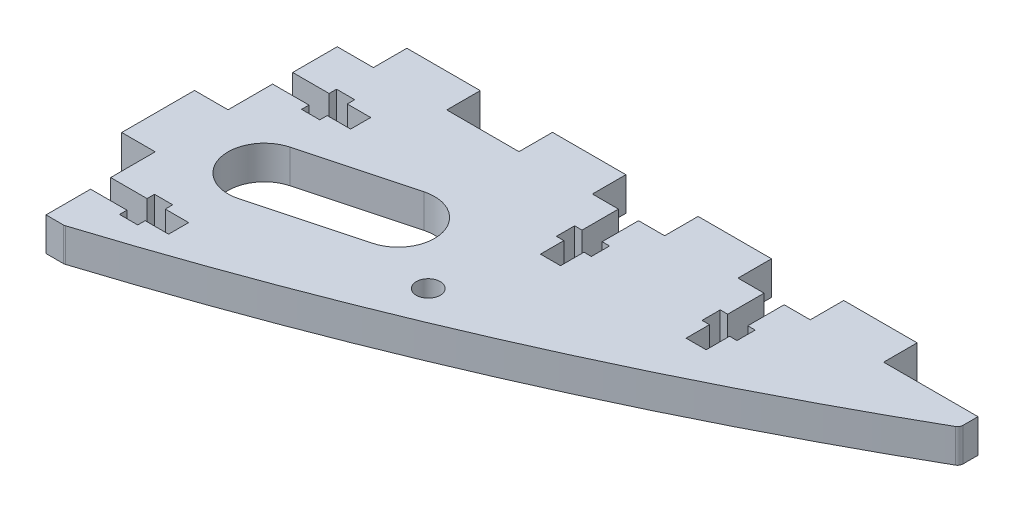
from build123d import *

# Parameters (mm, degrees)
BOSS_EXTRUDE1_DEPTH = 5.842
CUT_EXTRUDE1_DEPTH  = 123.902671239
FILLET1_R           = 1
CUT_EXTRUDE2_DEPTH  = 123.902671239
SKETCH5_R           = 2.0828
CUT_EXTRUDE3_DEPTH  = 123.902671239


with BuildPart() as part:
    # Sketch1 → Boss-Extrude1 (new body)
    with BuildSketch(Plane(origin=(0, 0, 0), x_dir=(1, 0, 0), z_dir=(0, 1, 0))):
        with BuildLine():
            Line((0, 0), (6.3, 0))
            Line((6.3, 0), (6.3, 5.842))
            Line((6.3, 5.842), (19.1, 5.842))
            Line((19.1, 5.842), (19.1, 0))
            Line((19.1, 0), (31.7, 0))
            Line((31.7, 0), (31.7, 5.842))
            Line((31.7, 5.842), (44.5, 5.842))
            Line((44.5, 5.842), (44.5, 0))
            Line((44.5, 0), (57.1, 0))
            Line((57.1, 0), (57.1, 5.842))
            Line((57.1, 5.842), (69.9, 5.842))
            Line((69.9, 5.842), (69.9, 0))
            Line((69.9, 0), (82.5, 0))
            Line((82.5, 0), (82.5, 5.842))
            Line((82.5, 5.842), (95.3, 5.842))
            Line((95.3, 5.842), (95.3, 0))
            Line((95.3, 0), (111.76, 0))
            Line((111.76, 0), (111.76, -3.175))
            add(Edge.make_bspline(
                [(3.175, -50.8), (60.036806346, -32.771807959), (111.76, -3.175)],
                knots=[0, 0, 0, 1, 1, 1], degree=2))
            Line((3.175, -50.8), (0, -50.8))
            Line((0, -50.8), (0, -31.75))
            Line((0, -31.75), (-5.842, -31.75))
            Line((-5.842, -31.75), (-5.842, -19.05))
            Line((-5.842, -19.05), (0, -19.05))
            Line((0, -19.05), (0, 0))
        make_face()
    extrude(amount=BOSS_EXTRUDE1_DEPTH)

    # Sketch3 → Cut-Extrude1 (cut, through all)
    with BuildSketch(Plane(origin=(0, 5.842, 0), x_dir=(1, 0, 0), z_dir=(0, 1, 0))):
        with BuildLine():
            Line((11.056499064, -19.28001312), (29.457386054, -14.349510311))
            ThreePointArc((29.457386054, -14.349510311), (37.234515988, -18.839638371), (32.744387927, -26.616768304))
            Line((32.744387927, -26.616768304), (14.343500936, -31.547271114))
            ThreePointArc((14.343500936, -31.547271114), (6.566371003, -27.057143053), (11.056499064, -19.28001312))
        make_face()
    extrude(amount=-CUT_EXTRUDE1_DEPTH, mode=Mode.SUBTRACT)

    # Fillet1
    fillet1_edges = [part.edges().sort_by_distance(p)[0] for p in [
        (3.175, 2.921, 50.8),
        (111.76, 2.921, 3.175),
    ]]
    fillet(fillet1_edges, radius=FILLET1_R)

    # Sketch4 → Cut-Extrude2 (cut, through all)
    with BuildSketch(Plane(origin=(0, 5.842, 0), x_dir=(1, 0, 0), z_dir=(0, 1, 0))):
        Polygon((49.0474, -6.35), (47.752, -6.35), (47.752, -9.525), (49.0474, -9.525), (49.0474, -13.608), (52.5526, -13.608), (52.5526, -9.525), (53.848, -9.525), (53.848, -6.35), (52.5526, -6.35), (52.5526, 0), (49.0474, 0), align=None)
        Polygon((74.4474, -6.35), (73.152, -6.35), (73.152, -9.525), (74.4474, -9.525), (74.4474, -13.608), (77.9526, -13.608), (77.9526, -9.525), (79.248, -9.525), (79.248, -6.35), (77.9526, -6.35), (77.9526, 0), (74.4474, 0), align=None)
        Polygon((9.525, -7.7724), (9.525, -6.477), (6.35, -6.477), (6.35, -7.7724), (0, -7.7724), (0, -11.2776), (6.35, -11.2776), (6.35, -12.573), (9.525, -12.573), (9.525, -11.2776), (13.607999962, -11.2776), (13.607999962, -7.7724), align=None)
        Polygon((6.35, -43.0276), (6.35, -44.323), (9.525, -44.323), (9.525, -43.0276), (13.607999962, -43.0276), (13.607999962, -39.5224), (9.525, -39.5224), (9.525, -38.227), (6.35, -38.227), (6.35, -39.5224), (0, -39.5224), (0, -43.0276), align=None)
    extrude(amount=-CUT_EXTRUDE2_DEPTH, mode=Mode.SUBTRACT)

    # Sketch5 → Cut-Extrude3 (cut, through all)
    with BuildSketch(Plane(origin=(0, 5.842, 0), x_dir=(1, 0, 0), z_dir=(0, 1, 0))):
        with Locations(Location((44.45, -28.575, 0), (0, 0, 270))):
            Circle(SKETCH5_R)
    extrude(amount=-CUT_EXTRUDE3_DEPTH, mode=Mode.SUBTRACT)


solid = part.part
